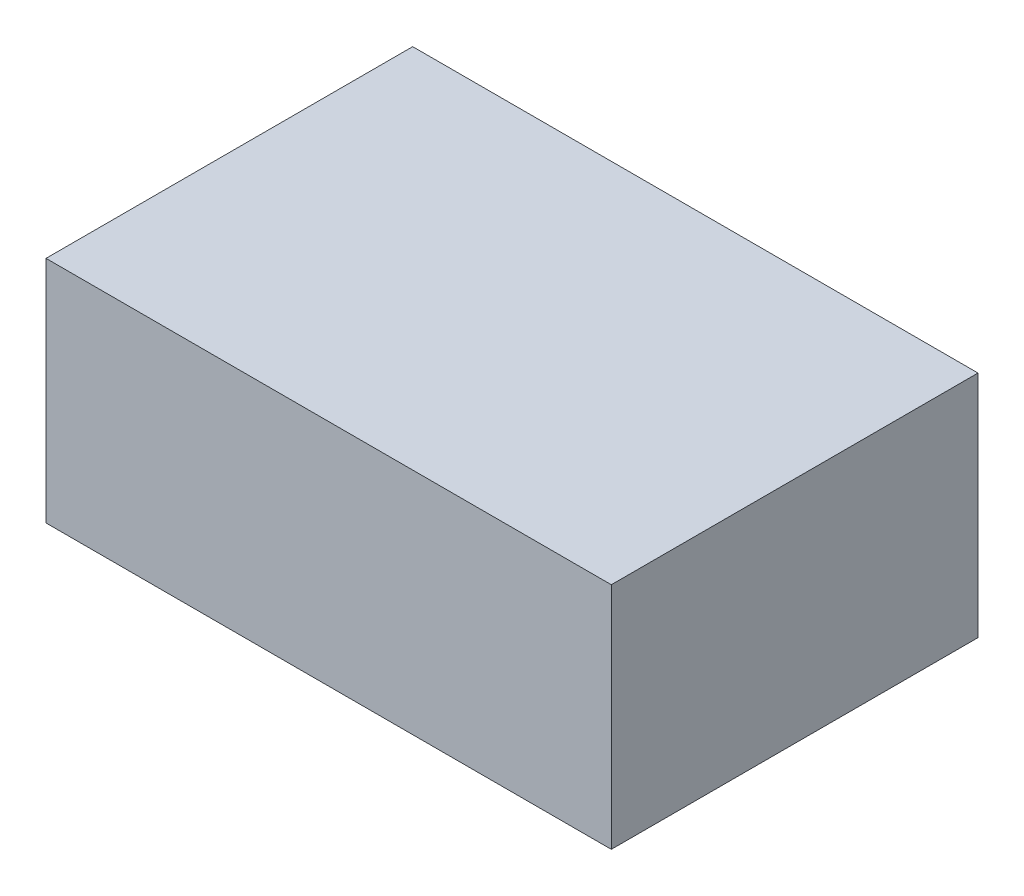
from build123d import *

# Parameters (mm, degrees)
SKETCH1_W           = 37
SKETCH1_H           = 24
BOSS_EXTRUDE1_DEPTH = 15


with BuildPart() as part:
    # Sketch1 → Boss-Extrude1 (new body)
    with BuildSketch(Plane(origin=(0, 0, 0), x_dir=(1, 0, 0), z_dir=(0, 1, 0))):
        with Locations((18.5, 12)):
            Rectangle(SKETCH1_W, SKETCH1_H)
    extrude(amount=BOSS_EXTRUDE1_DEPTH)


solid = part.part
